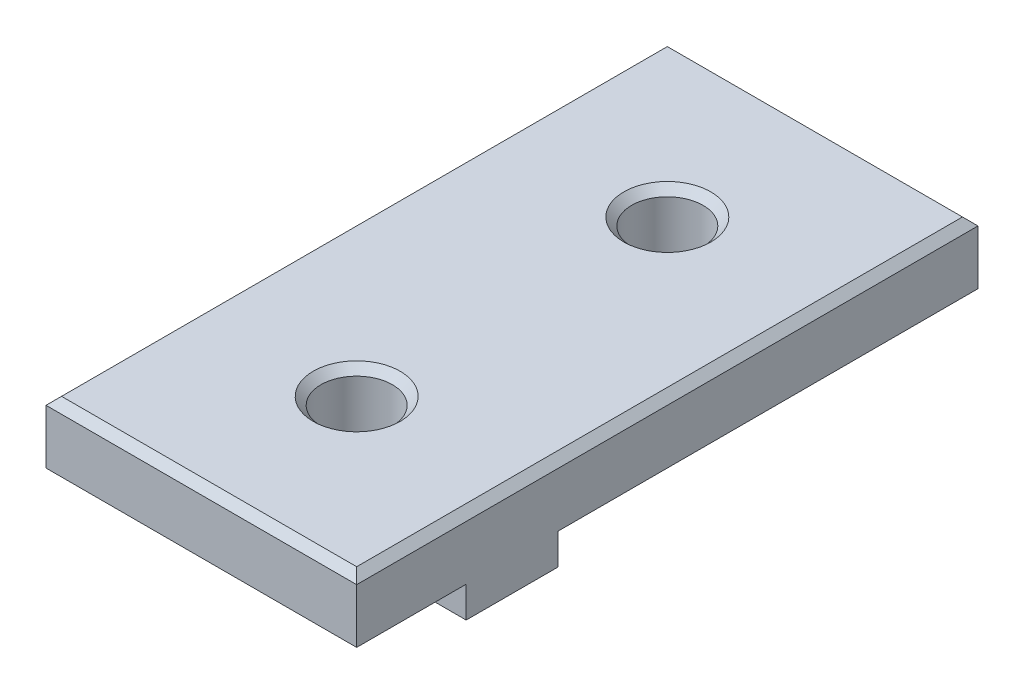
from build123d import *

# Parameters (mm, degrees)
ESBO_O1_W                  = 20
ESBO_O1_H                  = 40
RESSALTO_EXTRUS_O1_DEPTH   = 4
CORTE_EXTRUS_O1_DEPTH      = 23.715633383
CORTE_EXTRUS_O1_DEPTH_BACK = 23.715633383
ESBO_O2_R                  = 2.3
ESBO_O3_W                  = 5.9
ESBO_O3_H                  = 6
ESBO_O3_H_2                = 7
ESBO_O3_W_2                = 7
ESBO_O3_H_3                = 5.9
RESSALTO_EXTRUS_O2_DEPTH   = 2
CHANFRO1_SIZE              = 0.5


with BuildPart() as part:
    # Esboço1 → Ressalto-extrusão1 (new body)
    with BuildSketch(Plane(origin=(0, 0, 0), x_dir=(1, 0, 0), z_dir=(0, 1, 0))):
        Rectangle(ESBO_O1_W, ESBO_O1_H)
    extrude(amount=RESSALTO_EXTRUS_O1_DEPTH)

    # Esboço2 → Corte-extrusão1 (cut, two sides: drawn at the far end of the back side and taken through both)
    with BuildSketch(Plane(origin=(0, 4, 0), x_dir=(1, 0, 0), z_dir=(0, 1, 0)).offset(-CORTE_EXTRUS_O1_DEPTH_BACK)):
        with Locations(Location((0, 10, 0), (0, 0, 270))):
            Circle(ESBO_O2_R)
        with Locations(Location((0, -10, 0), (0, 0, 270))):
            Circle(ESBO_O2_R)
    extrude(amount=CORTE_EXTRUS_O1_DEPTH + CORTE_EXTRUS_O1_DEPTH_BACK, mode=Mode.SUBTRACT)

    # Esboço3 → Ressalto-extrusão2 (add)
    with BuildSketch(Plane.XZ):
        with Locations((0, -4)):
            Rectangle(ESBO_O3_W, ESBO_O3_H)
        with Locations((0, -16.5)):
            Rectangle(ESBO_O3_W, ESBO_O3_H_2)
        with Locations((-6.5, 10)):
            Rectangle(ESBO_O3_W_2, ESBO_O3_H_3)
        with Locations((6.5, 10)):
            Rectangle(ESBO_O3_W_2, ESBO_O3_H_3)
    extrude(amount=RESSALTO_EXTRUS_O2_DEPTH)

    # Chanfro1
    chanfro1_edges = [part.edges().sort_by_distance(p)[0] for p in [
        (-10, 4, 0),
        (0, 4, 20),
        (0, 4, -12.3),
        (0, 4, 7.7),
        (10, 4, 0),
        (0, 4, -20),
    ]]
    chamfer(chanfro1_edges, length=CHANFRO1_SIZE)


solid = part.part
